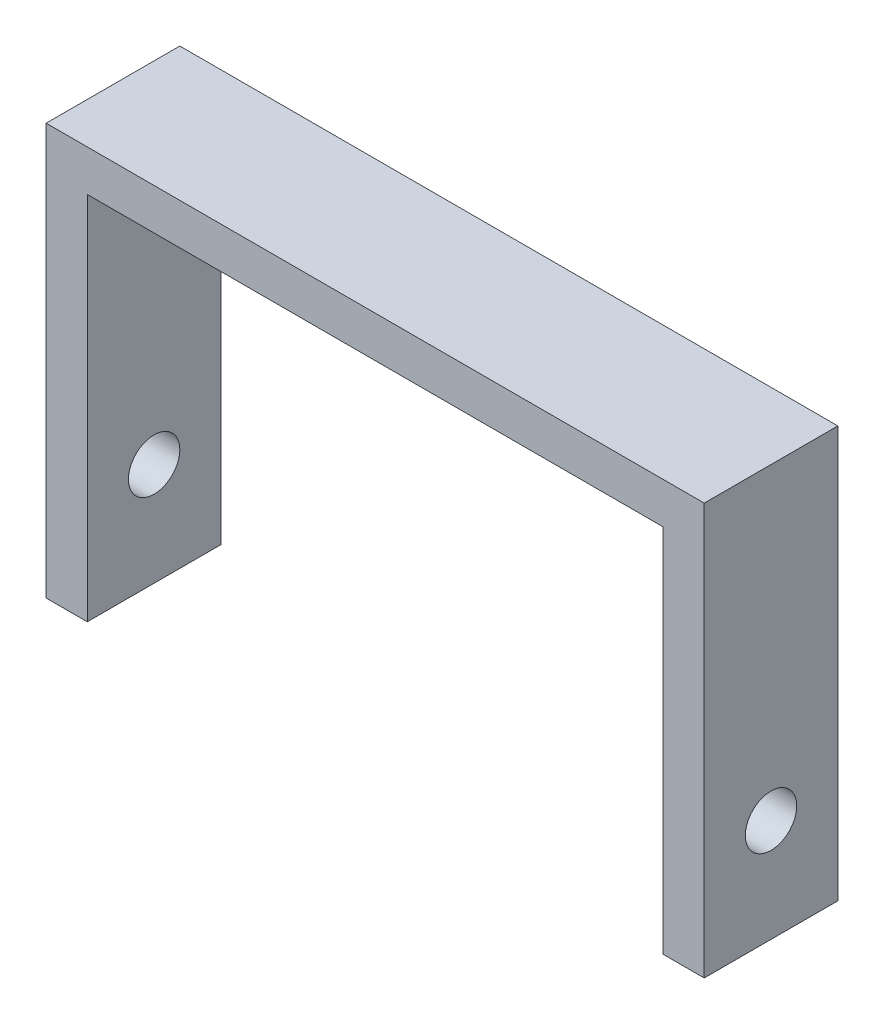
from build123d import *

# Parameters (mm, degrees)
BOSS_EXTRU_1_DEPTH      = 13
ESQUISSE2_R             = 2.5
ENL_V_MAT_EXTRU_1_DEPTH = 77.583287994


with BuildPart() as part:
    # Esquisse1 → Boss.-Extru.1 (new body)
    with BuildSketch(Plane.XY):
        Polygon((0, 0), (0, 40), (64, 40), (64, 0), (60, 0), (60, 36), (4, 36), (4, 0), align=None)
    extrude(amount=BOSS_EXTRU_1_DEPTH)

    # Esquisse2 → Enlèv. mat.-Extru.1 (cut, through all)
    with BuildSketch(Plane(origin=(64, 0, 0), x_dir=(0, 0, -1), z_dir=(1, 0, 0))):
        with Locations((-6.5, 10)):
            Circle(ESQUISSE2_R)
    extrude(amount=-ENL_V_MAT_EXTRU_1_DEPTH, mode=Mode.SUBTRACT)


solid = part.part
